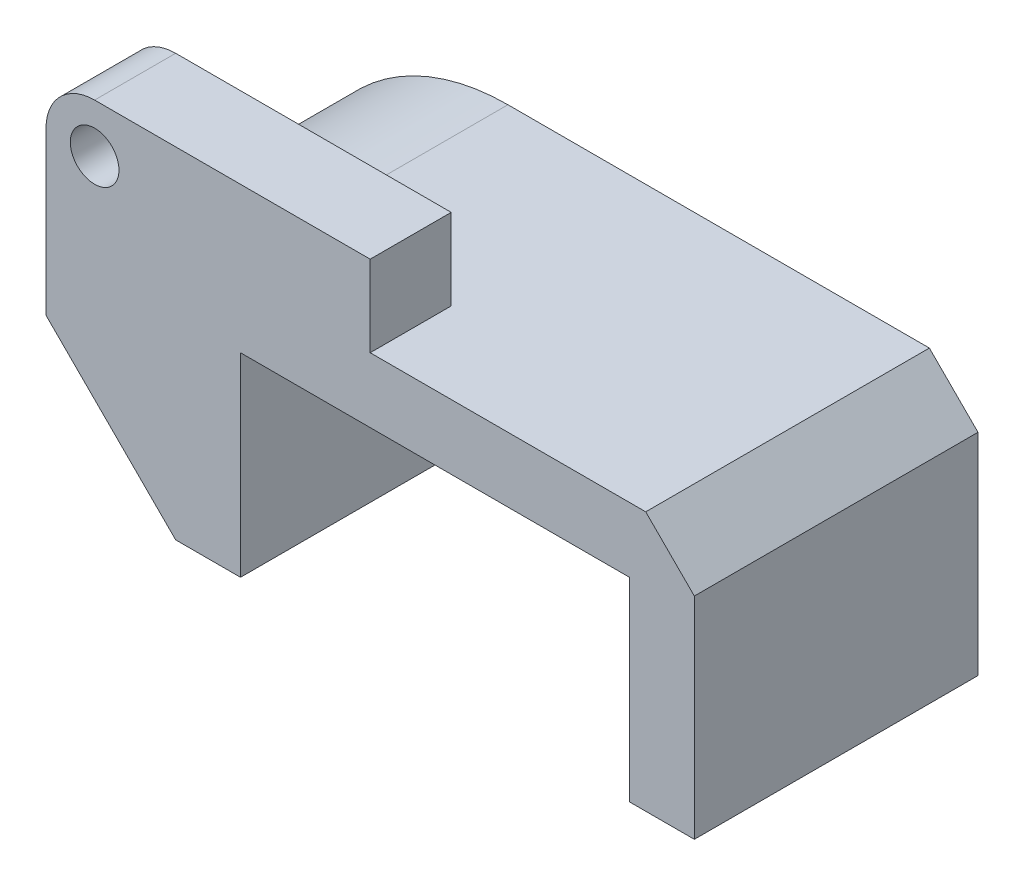
from build123d import *

# Parameters (mm, degrees)
BOSS_EXTRUDE1_DEPTH = 17.5
CHAMFER1_SIZE       = 3
BOSS_EXTRUDE2_DEPTH = 5
CHAMFER2_SIZE       = 8
SKETCH3_R           = 1.5
CUT_EXTRUDE1_DEPTH  = 33.035136959
FILLET1_R           = 3
SKETCH4_R           = 1
CUT_EXTRUDE2_DEPTH  = 8
BOSS_EXTRUDE3_DEPTH = 12.5


with BuildPart() as part:
    # Sketch1 → Boss-Extrude1 (new body)
    with BuildSketch(Plane.XY):
        Polygon((12, -12), (16, -12), (16, 4), (-16, 4), (-16, -12), (-12, -12), (-12, 0), (12, 0), align=None)
    extrude(amount=BOSS_EXTRUDE1_DEPTH)

    # Chamfer1
    chamfer1_edges = [part.edges().sort_by_distance(p)[0] for p in [
        (-16, 4, 8.75),
        (16, 4, 8.75),
    ]]
    chamfer(chamfer1_edges, length=CHAMFER1_SIZE)

    # Sketch2 → Boss-Extrude2 (add)
    with BuildSketch(Plane.XY.offset(17.5)):
        Polygon((-16, 1), (-4, 1), (-4, 9), (-16, 9), (-24, 9), (-24, -12), (-16, -12), align=None)
    extrude(amount=-BOSS_EXTRUDE2_DEPTH)

    # Chamfer2
    chamfer2_edges = [part.edges().sort_by_distance(p)[0] for p in [
        (-24, -12, 15),
    ]]
    chamfer(chamfer2_edges, length=CHAMFER2_SIZE)

    # Sketch3 → Cut-Extrude1 (cut, through all)
    with BuildSketch(Plane.XY.offset(17.5)):
        with Locations((-21, 6)):
            Circle(SKETCH3_R)
    extrude(amount=-CUT_EXTRUDE1_DEPTH, mode=Mode.SUBTRACT)

    # Fillet1
    fillet1_edges = [part.edges().sort_by_distance(p)[0] for p in [
        (-24, 9, 15),
    ]]
    fillet(fillet1_edges, radius=FILLET1_R)

    # Sketch4 → Cut-Extrude2 (cut)
    with BuildSketch(Plane(origin=(0, 0, 0), x_dir=(-1, 0, 0), z_dir=(0, 0, -1))):
        with Locations((-14.5, -6)):
            Circle(SKETCH4_R)
        with Locations((14.5, -6)):
            Circle(SKETCH4_R)
    extrude(amount=-CUT_EXTRUDE2_DEPTH, mode=Mode.SUBTRACT)

    # Sketch5 → Boss-Extrude3 (add)
    with BuildSketch(Plane(origin=(0, 0, 0), x_dir=(-1, 0, 0), z_dir=(0, 0, -1))):
        with BuildLine():
            Line((13, 4), (16, 1))
            Line((16, 1), (16, -12))
            Line((16, -12), (24, -4))
            Line((24, -4), (24, -2))
            ThreePointArc((24, -2), (19.264982043, 2.402467079), (13, 4))
        make_face()
    extrude(amount=-BOSS_EXTRUDE3_DEPTH)


solid = part.part
